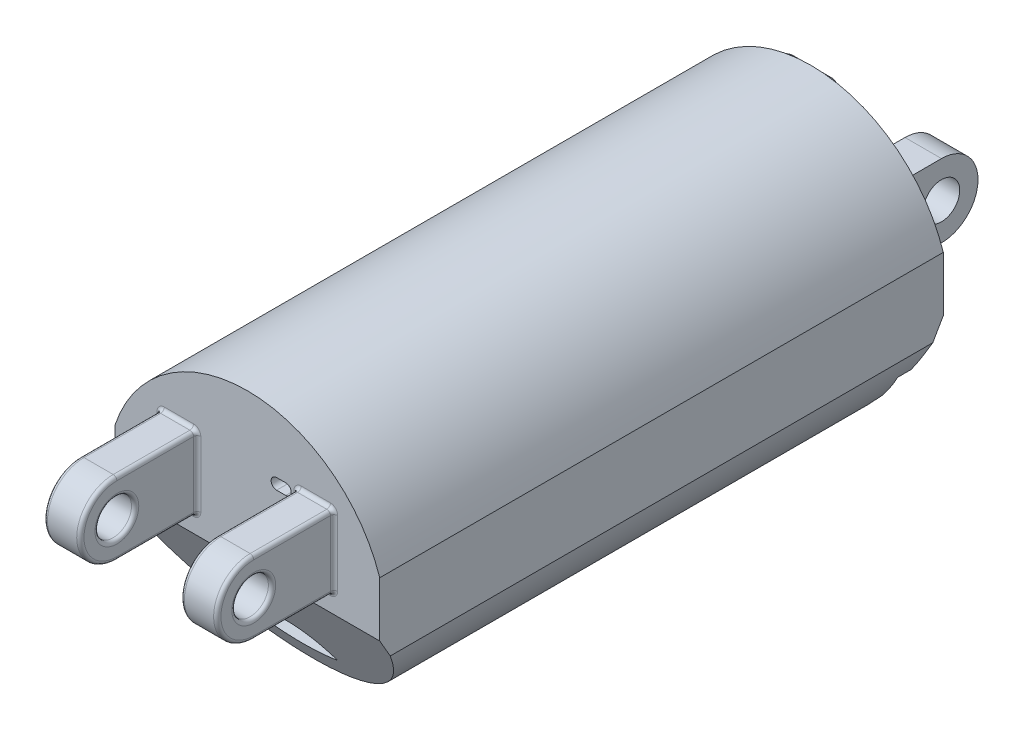
from build123d import *

# Parameters (mm, degrees)
BOSS_EXTRUDE1_DEPTH     = 19.605625
CUT_EXTRUDE1_DEPTH      = 30.35126084
CUT_EXTRUDE2_DEPTH      = 45.884720204
SKETCH4_R               = 1.27
BOSS_EXTRUDE2_DEPTH     = 0.635
SKETCH5_R               = 1.27
BOSS_EXTRUDE3_DEPTH     = 1.27
MIRROR2_COPY_1_SKETCH_R = 1.27
MIRROR2_COPY_1_DEPTH    = 0.635
MIRROR2_COPY_2_SKETCH_R = 1.27
MIRROR2_COPY_2_DEPTH    = 1.27
SKETCH10_R              = 1.27
BOSS_EXTRUDE6_DEPTH     = 2.54
BOSS_EXTRUDE7_START     = -2.54
BOSS_EXTRUDE7_DEPTH     = 2.54
CUT_EXTRUDE5_REACH      = 35.755
SKETCH11_R              = 1.27
CUT_EXTRUDE7_DEPTH      = 13.97
CUT_EXTRUDE8_DEPTH      = 16.51
FILLET1_R               = 0.254
SKETCH18_W              = 1.905
SKETCH18_H              = 11.7475
CUT_EXTRUDE9_DEPTH      = 2.54
SKETCH19_W              = 0.284935898
SKETCH19_H              = 2.320192308
CUT_EXTRUDE10_DEPTH     = 1


with BuildPart() as part:
    # Sketch1 → Boss-Extrude1 (new, symmetric)
    with BuildSketch(Plane.XY):
        with BuildLine():
            Line((0, 0), (0, 5.08))
            ThreePointArc((0, 5.08), (9.2075, 11.7475), (18.415, 5.08))
            Line((18.415, 5.08), (18.415, 0))
            ThreePointArc((18.415, 0), (9.2075, -6.6675), (0, 0))
        make_face()
    extrude(amount=BOSS_EXTRUDE1_DEPTH, both=True)

    # Sketch2 → Cut-Extrude1 (cut, through all)
    with BuildSketch(Plane(origin=(0, 0, 0), x_dir=(0, 0, -1), z_dir=(1, 0, 0))):
        Polygon((-19.605625, 1.27), (-19.605625, -6.6675), (-15.022907238, -6.6675), align=None)
        Polygon((19.605625, -6.6675), (15.022907238, -6.6675), (19.605625, 1.27), align=None)
    extrude(amount=CUT_EXTRUDE1_DEPTH, mode=Mode.SUBTRACT)

    # Sketch3 → Cut-Extrude2 (cut, through all)
    with BuildSketch(Plane.XY.offset(19.605625)):
        with BuildLine():
            ThreePointArc((6.530334947, -4.960627925), (9.2075, -3.4925), (11.884665053, -4.960627925))
            ThreePointArc((11.884665053, -4.960627925), (9.2075, -5.3975), (6.530334947, -4.960627925))
        make_face()
    extrude(amount=-CUT_EXTRUDE2_DEPTH, mode=Mode.SUBTRACT)

    # Sketch4 → Boss-Extrude2 (add, symmetric)
    with BuildSketch(Plane(origin=(14.605, 0, 0), x_dir=(0, 0, -1), z_dir=(1, 0, 0))):
        with BuildLine():
            Line((-19.605625, 7.62), (-22.653625, 7.62))
            ThreePointArc((-22.653625, 7.62), (-25.193625, 5.08), (-22.653625, 2.54))
            Line((-22.653625, 2.54), (-19.605625, 2.54))
            Line((-19.605625, 2.54), (-19.605625, 7.62))
        make_face()
        with Locations((-22.653625, 5.08)):
            Circle(SKETCH4_R, mode=Mode.SUBTRACT)
    boss_extrude2 = extrude(amount=BOSS_EXTRUDE2_DEPTH, both=True)

    # Sketch5 → Boss-Extrude3 (add)
    with BuildSketch(Plane.ZY.offset(-13.97)):
        with BuildLine():
            Line((19.605625, 7.62), (19.605625, 2.54))
            Line((19.605625, 2.54), (22.653625, 2.54))
            ThreePointArc((22.653625, 2.54), (25.193625, 5.08), (22.653625, 7.62))
            Line((22.653625, 7.62), (19.605625, 7.62))
        make_face()
        with Locations((22.653625, 5.08)):
            Circle(SKETCH5_R, mode=Mode.SUBTRACT)
    boss_extrude3 = extrude(amount=BOSS_EXTRUDE3_DEPTH)

    # Mirror1: Boss-Extrude2, Boss-Extrude3 across plane
    add(boss_extrude2.mirror(Plane(origin=(9.2075, 0, 0), x_dir=(0, 0, 1), z_dir=(1, 0, 0))))
    add(boss_extrude3.mirror(Plane(origin=(9.2075, 0, 0), x_dir=(0, 0, 1), z_dir=(1, 0, 0))))

    # Mirror2: Boss-Extrude2, Boss-Extrude3 across plane
    add(boss_extrude2.mirror(Plane.XY))
    add(boss_extrude3.mirror(Plane.XY))

    # Mirror2 copy 1 sketch → Mirror2 copy 1 (add, symmetric)
    with BuildSketch(Plane.ZY.offset(-3.81)):
        with BuildLine():
            Line((-19.605625, 7.62), (-22.653625, 7.62))
            ThreePointArc((-22.653625, 7.62), (-25.193625, 5.08), (-22.653625, 2.54))
            Line((-22.653625, 2.54), (-19.605625, 2.54))
            Line((-19.605625, 2.54), (-19.605625, 7.62))
        make_face()
        with Locations((-22.653625, 5.08)):
            Circle(MIRROR2_COPY_1_SKETCH_R, mode=Mode.SUBTRACT)
    extrude(amount=MIRROR2_COPY_1_DEPTH, both=True)

    # Mirror2 copy 2 sketch → Mirror2 copy 2 (add)
    with BuildSketch(Plane(origin=(4.445, 0, 0), x_dir=(0, 0, -1), z_dir=(1, 0, 0))):
        with BuildLine():
            Line((19.605625, 7.62), (19.605625, 2.54))
            Line((19.605625, 2.54), (22.653625, 2.54))
            ThreePointArc((22.653625, 2.54), (25.193625, 5.08), (22.653625, 7.62))
            Line((22.653625, 7.62), (19.605625, 7.62))
        make_face()
        with Locations((22.653625, 5.08)):
            Circle(MIRROR2_COPY_2_SKETCH_R, mode=Mode.SUBTRACT)
    extrude(amount=MIRROR2_COPY_2_DEPTH)

    # Sketch10 → Boss-Extrude6 (add)
    with BuildSketch(Plane(origin=(15.24, 0, 0), x_dir=(0, 0, -1), z_dir=(1, 0, 0))):
        with BuildLine():
            Line((-19.605625, 7.62), (-25.193625, 7.62))
            ThreePointArc((-25.193625, 7.62), (-27.733625, 5.08), (-25.193625, 2.54))
            Line((-25.193625, 2.54), (-19.605625, 2.54))
            Line((-19.605625, 2.54), (-19.605625, 7.62))
        make_face()
        with Locations((-25.193625, 5.08)):
            Circle(SKETCH10_R, mode=Mode.SUBTRACT)
    extrude(amount=-BOSS_EXTRUDE6_DEPTH)

    # Sketch12 → Boss-Extrude7 (add)
    with BuildSketch(Plane.ZY.offset(-3.175).offset(BOSS_EXTRUDE7_START)):
        with BuildLine():
            Line((19.605625, 7.62), (25.193625, 7.62))
            ThreePointArc((25.193625, 7.62), (27.733625, 5.08), (25.193625, 2.54))
            Line((25.193625, 2.54), (19.605625, 2.54))
            Line((19.605625, 2.54), (19.605625, 7.62))
        make_face()
    extrude(amount=BOSS_EXTRUDE7_DEPTH)

    # Sketch11 → Cut-Extrude5 (cut, up to next)
    with BuildSketch(Plane(origin=(15.24, 0, 0), x_dir=(0, 0, -1), z_dir=(1, 0, 0)), mode=Mode.PRIVATE) as cut_extrude5_sk1:
        with Locations((-25.193625, 5.08)):
            Circle(SKETCH11_R)
    cut_extrude5_tool1 = extrude(cut_extrude5_sk1.sketch, amount=-CUT_EXTRUDE5_REACH, mode=Mode.PRIVATE) & part.part
    add(cut_extrude5_tool1.solids().sort_by_distance((15.24, 5.08, 25.193625))[0], mode=Mode.SUBTRACT)
    add(cut_extrude5_tool1.solids().sort_by_distance((15.24, 5.08, 25.193625))[1], mode=Mode.SUBTRACT)

    # Sketch16 → Cut-Extrude7 (cut)
    with BuildSketch(Plane.XY.offset(19.605625)):
        with BuildLine():
            Line((11.2395, 7.5311), (11.8745, 7.5311))
            ThreePointArc((11.8745, 7.5311), (12.2555, 7.1501), (11.8745, 6.7691))
            Line((11.8745, 6.7691), (11.2395, 6.7691))
            ThreePointArc((11.2395, 6.7691), (10.8585, 7.1501), (11.2395, 7.5311))
        make_face()
    extrude(amount=-CUT_EXTRUDE7_DEPTH, mode=Mode.SUBTRACT)

    # Sketch17 → Cut-Extrude8 (cut)
    with BuildSketch(Plane(origin=(0, 0, -19.605625), x_dir=(-1, 0, 0), z_dir=(0, 0, -1))):
        with BuildLine():
            Line((-7.5565, 7.5311), (-6.9215, 7.5311))
            ThreePointArc((-6.9215, 7.5311), (-6.5405, 7.1501), (-6.9215, 6.7691))
            Line((-6.9215, 6.7691), (-7.5565, 6.7691))
            ThreePointArc((-7.5565, 6.7691), (-7.9375, 7.1501), (-7.5565, 7.5311))
        make_face()
    extrude(amount=-CUT_EXTRUDE8_DEPTH, mode=Mode.SUBTRACT)

    # Fillet1
    fillet1_edges = [part.edges().sort_by_distance(p)[0] for p in [
        (3.175, 5.08, 19.605625),
        (4.445, 7.62, 19.605625),
        (3.175, 2.54, 22.399625),
        (4.445, 2.54, 19.605625),
        (3.175, 7.62, 22.399625),
        (5.715, 7.62, 22.399625),
        (5.715, 2.54, 22.399625),
        (5.715, 5.08, 19.605625),
        (15.24, 3.850327788, 25.511125),
        (12.7, 5.08, 27.733625),
        (15.24, 5.08, 27.733625),
        (12.7, 3.850327788, 25.511125),
        (3.175, 5.08, 27.733625),
        (5.715, 5.08, 27.733625),
        (5.715, 5.08, 26.463625),
        (3.175, 5.08, 26.463625),
        (15.24, 5.08, 19.605625),
        (15.24, 7.62, 22.399625),
        (15.24, 2.54, 22.399625),
        (13.97, 2.54, 19.605625),
        (13.97, 7.62, 19.605625),
        (12.7, 7.62, 22.399625),
        (12.7, 5.08, 19.605625),
        (12.7, 2.54, 22.399625),
    ]]
    fillet(fillet1_edges, radius=FILLET1_R)

    # Sketch18 → Cut-Extrude9 (cut)
    with BuildSketch(Plane(origin=(0, 0, -19.605625), x_dir=(-1, 0, 0), z_dir=(0, 0, -1))):
        with Locations((-16.8275, -0.79375)):
            Rectangle(SKETCH18_W, SKETCH18_H)
        with Locations((-1.5875, -0.79375)):
            Rectangle(SKETCH18_W, SKETCH18_H)
    extrude(amount=-CUT_EXTRUDE9_DEPTH, mode=Mode.SUBTRACT)

    # Sketch19 → Cut-Extrude10 (cut)
    # profile 1 of 5: a face of its own
    with BuildSketch(Plane.ZY):
        Polygon((-8.545405736, 1.375249249), (-8.126270119, 4.550249249), (-8.085564991, 4.550249249), (-6.774732659, 1.945121044), (-5.467080416, 4.550249249), (-5.42573927, 4.550249249), (-5.004059583, 1.375249249), (-5.290267515, 1.375249249), (-5.594283942, 3.65982457), (-6.740387708, 1.375249249), (-6.804625488, 1.375249249), (-7.955181377, 3.664912711), (-8.258561786, 1.375249249), align=None)
    # profile 2 of 5: a face of its own
    with BuildSketch(Plane.ZY):
        with BuildLine():
            add(Edge.make_bspline(
                [(-4.333697002, 4.672364634), (-4.316015595, 4.671544438), (-4.281392002, 4.669938338), (-4.231323823, 4.656184713), (-4.185733534, 4.632871427), (-4.145295162, 4.60159343), (-4.110595236, 4.564809292), (-4.086301306, 4.521936843), (-4.070687204, 4.475619363), (-4.068801657, 4.443311389), (-4.067841634, 4.426861829)],
                knots=[0, 0, 0, 0, 1.055194115, 2.066272739, 3.074728998, 4.095836921, 5.109056067, 6.073838105, 7.019297344, 8, 8, 8, 8], degree=3))
            add(Edge.make_bspline(
                [(-4.067841634, 4.426861829), (-4.068823307, 4.41083928), (-4.07076396, 4.379164595), (-4.086289246, 4.333650088), (-4.110802276, 4.291373346), (-4.145272911, 4.25466063), (-4.18573943, 4.223399925), (-4.231322257, 4.200082054), (-4.281392414, 4.186329644), (-4.316015734, 4.184723376), (-4.333697002, 4.183903095)],
                knots=[0, 0, 0, 0, 0.96129708, 1.900370562, 2.859976407, 3.87933698, 4.906634145, 5.921202961, 6.938410037, 8, 8, 8, 8], degree=3))
            add(Edge.make_bspline(
                [(-4.333697002, 4.183903095), (-4.351176081, 4.184692056), (-4.385196823, 4.186227664), (-4.434515315, 4.200351895), (-4.479716874, 4.223407904), (-4.520234112, 4.254455943), (-4.554007216, 4.291598814), (-4.578589268, 4.333624288), (-4.594078698, 4.379171164), (-4.596024183, 4.410841486), (-4.5970083, 4.426861829)],
                knots=[0, 0, 0, 0, 1.054934014, 2.053291228, 3.073705704, 4.106921865, 5.123545215, 6.088680038, 7.033164197, 8, 8, 8, 8], degree=3))
            add(Edge.make_bspline(
                [(-4.5970083, 4.426861829), (-4.596045743, 4.4433091), (-4.59415522, 4.475612577), (-4.578577658, 4.521963072), (-4.554211975, 4.564582005), (-4.52021175, 4.601797994), (-4.479722825, 4.632863496), (-4.434513778, 4.655914886), (-4.385197229, 4.670040315), (-4.351176218, 4.671575758), (-4.333697002, 4.672364634)],
                knots=[0, 0, 0, 0, 0.98631895, 1.937192651, 2.907499808, 3.917963147, 4.944918757, 5.95915025, 6.951458133, 8, 8, 8, 8], degree=3))
        make_face()
    # profile 3 of 5: a face of its own
    with BuildSketch(Plane.ZY):
        with Locations((-4.332424967, 2.535345403)):
            Rectangle(SKETCH19_W, SKETCH19_H)
    # profile 4 of 5: a face of its own
    with BuildSketch(Plane.ZY):
        with BuildLine():
            Line((-1.137072403, 4.631659506), (-1.137072403, 1.375249249))
            Line((-1.137072403, 1.375249249), (-1.4220083, 1.375249249))
            Line((-1.4220083, 1.375249249), (-1.4220083, 1.776576373))
            add(Edge.make_bspline(
                [(-1.4220083, 1.776576373), (-1.454138203, 1.740254741), (-1.516840113, 1.66937262), (-1.621561699, 1.576769506), (-1.732567117, 1.500226315), (-1.849317601, 1.438404605), (-1.971707722, 1.391966097), (-2.099466173, 1.358958653), (-2.232645068, 1.337737102), (-2.323588276, 1.335617997), (-2.369674567, 1.334544121)],
                knots=[0, 0, 0, 0, 1.074387032, 2.096679803, 3.090159297, 4.057316773, 5.018401886, 5.985159533, 6.978961417, 8, 8, 8, 8], degree=3))
            add(Edge.make_bspline(
                [(-2.369674567, 1.334544121), (-2.410648353, 1.335656616), (-2.491450475, 1.337850505), (-2.610312566, 1.354870595), (-2.72469625, 1.382203373), (-2.834709612, 1.420213465), (-2.939640772, 1.470633211), (-3.040388146, 1.530995629), (-3.136429802, 1.602878382), (-3.226301841, 1.685054665), (-3.309062299, 1.774312974), (-3.38168931, 1.869513578), (-3.44224389, 1.97024481), (-3.492880677, 2.075231314), (-3.531884504, 2.185281277), (-3.559074872, 2.300014136), (-3.576075135, 2.419294236), (-3.578268117, 2.500519375), (-3.579380095, 2.541705579)],
                knots=[0, 0, 0, 0, 1.033919861, 2.038935746, 3.024066025, 3.998881131, 4.97069526, 5.957263378, 6.95902576, 7.993208707, 9.027059324, 10.027763471, 11.009749337, 11.988697705, 12.965288445, 13.950418724, 14.960734635, 16, 16, 16, 16], degree=3))
            add(Edge.make_bspline(
                [(-3.579380095, 2.541705579), (-3.578243471, 2.58204051), (-3.575996427, 2.661780493), (-3.55925672, 2.779054741), (-3.531107162, 2.892010592), (-3.491603044, 3.00028439), (-3.440946413, 3.10400715), (-3.379325934, 3.20325223), (-3.306737157, 3.29829304), (-3.223051045, 3.386894796), (-3.132395932, 3.468737782), (-3.03541444, 3.539865987), (-2.934519035, 3.601294843), (-2.828144732, 3.649966211), (-2.717866002, 3.68934447), (-2.60270109, 3.716588662), (-2.483129158, 3.732642661), (-2.401948497, 3.734967454), (-2.36077032, 3.736146685)],
                knots=[0, 0, 0, 0, 1.020392517, 2.01726096, 2.990465484, 3.961182959, 4.928053699, 5.906110375, 6.912531644, 7.948652711, 8.985773172, 9.998621852, 10.987621588, 11.969261332, 12.953316658, 13.946091881, 14.958173133, 16, 16, 16, 16], degree=3))
            add(Edge.make_bspline(
                [(-2.36077032, 3.736146685), (-2.313402216, 3.734725105), (-2.220423891, 3.731934702), (-2.084444518, 3.708615354), (-1.9558229, 3.669460458), (-1.833818547, 3.615856224), (-1.71915881, 3.546186971), (-1.611003215, 3.462048158), (-1.511232629, 3.361058533), (-1.45220319, 3.285210891), (-1.4220083, 3.246413111)],
                knots=[0, 0, 0, 0, 1.031072012, 2.023879775, 2.993683497, 3.952812103, 4.918022106, 5.908088563, 6.929940113, 8, 8, 8, 8], degree=3))
            Line((-1.4220083, 3.246413111), (-1.4220083, 4.631659506))
            Line((-1.4220083, 4.631659506), (-1.137072403, 4.631659506))
        make_face()
        with BuildLine():
            add(Edge.make_bspline(
                [(-2.356954214, 3.451210788), (-2.398605078, 3.449728845), (-2.480817258, 3.446803725), (-2.601507174, 3.423967769), (-2.716998628, 3.385972459), (-2.826713995, 3.334009591), (-2.928920163, 3.268669237), (-3.020263707, 3.189637697), (-3.101491729, 3.099071262), (-3.169807083, 2.997378634), (-3.225497034, 2.888359937), (-3.264655699, 2.774400625), (-3.290481373, 2.65755611), (-3.293119817, 2.578305673), (-3.294444198, 2.538525491)],
                knots=[0, 0, 0, 0, 1.031046209, 2.035121221, 3.029706178, 4.034933723, 5.034054252, 6.02443088, 7.017295772, 8.038157696, 9.050218397, 10.03989886, 11.016116709, 12, 12, 12, 12], degree=3))
            add(Edge.make_bspline(
                [(-3.294444198, 2.538525491), (-3.292752473, 2.498983037), (-3.289375655, 2.420053121), (-3.265108954, 2.303049312), (-3.224396497, 2.189063145), (-3.168841197, 2.079062101), (-3.099275473, 1.976932239), (-3.018640767, 1.884639413), (-2.926157298, 1.805273858), (-2.823715916, 1.738836917), (-2.714307257, 1.685168058), (-2.599250762, 1.647824942), (-2.480709291, 1.623715099), (-2.400107531, 1.620898895), (-2.359498284, 1.619480018)],
                knots=[0, 0, 0, 0, 0.979072187, 1.954306742, 2.945804271, 3.96968567, 4.997920485, 5.998718438, 6.996577872, 8.005894225, 9.015743152, 10.005417472, 10.995077863, 12, 12, 12, 12], degree=3))
            add(Edge.make_bspline(
                [(-2.359498284, 1.619480018), (-2.318271814, 1.620985843), (-2.236276453, 1.623980778), (-2.115228483, 1.646914497), (-1.997758052, 1.684804765), (-1.885465352, 1.737327544), (-1.780857147, 1.802421717), (-1.686969787, 1.878628149), (-1.607580301, 1.967258895), (-1.540277006, 2.064664677), (-1.487503592, 2.171446274), (-1.449062453, 2.28514229), (-1.426334981, 2.405756683), (-1.423470469, 2.488183245), (-1.4220083, 2.530257262)],
                knots=[0, 0, 0, 0, 1.01762866, 2.023962475, 3.030623092, 4.058876274, 5.077231937, 6.066672613, 7.034107872, 8.005628644, 8.981990164, 9.965428785, 10.961468474, 12, 12, 12, 12], degree=3))
            add(Edge.make_bspline(
                [(-1.4220083, 2.530257262), (-1.422878846, 2.562313723), (-1.424592355, 2.625410981), (-1.437682943, 2.718055229), (-1.45850634, 2.806713681), (-1.487848937, 2.891479549), (-1.526394603, 2.97188417), (-1.572883647, 3.048504867), (-1.628133591, 3.120943137), (-1.691255037, 3.188201494), (-1.760347756, 3.249548356), (-1.833458518, 3.304307346), (-1.911453524, 3.349291447), (-1.993021122, 3.386521744), (-2.078302833, 3.416148258), (-2.167992609, 3.435912809), (-2.261137119, 3.449483957), (-2.324678898, 3.450629117), (-2.356954214, 3.451210788)],
                knots=[0, 0, 0, 0, 1.050140795, 2.067009409, 3.05949893, 4.030605086, 5.00011959, 5.97591094, 6.962425594, 7.979863591, 8.993523472, 9.986985069, 10.967611495, 11.937549037, 12.921786183, 13.919465291, 14.943216303, 16, 16, 16, 16], degree=3))
        make_face(mode=Mode.SUBTRACT)
    # profile 5 of 5: a face of its own
    with BuildSketch(Plane.ZY):
        with BuildLine():
            Line((0.938889135, 3.817556941), (0.653953238, 3.817556941))
            add(Edge.make_bspline(
                [(0.653953238, 3.817556941), (0.661672616, 3.849517838), (0.676763369, 3.911998776), (0.708239025, 4.001268219), (0.742528349, 4.085744557), (0.783702751, 4.163845995), (0.828614264, 4.237142142), (0.880069876, 4.303970562), (0.935695624, 4.366030895), (0.997222542, 4.421106475), (1.0617464, 4.470979129), (1.130176376, 4.513501503), (1.201135715, 4.55008127), (1.275116057, 4.580216766), (1.352337656, 4.602918491), (1.432102386, 4.619389308), (1.514619275, 4.630085533), (1.570633161, 4.631129439), (1.599075433, 4.631659506)],
                knots=[0, 0, 0, 0, 1.162005537, 2.271625781, 3.343758855, 4.383309926, 5.390229558, 6.379919256, 7.361854164, 8.333198761, 9.295911338, 10.242430842, 11.177959212, 12.116337295, 13.062827104, 14.020064771, 14.994644689, 16, 16, 16, 16], degree=3))
            add(Edge.make_bspline(
                [(1.599075433, 4.631659506), (1.640516207, 4.630408347), (1.722493809, 4.62793332), (1.842928859, 4.605332367), (1.959067474, 4.56956814), (2.069638434, 4.520152688), (2.172343727, 4.459204196), (2.263725839, 4.386664757), (2.342546131, 4.303933962), (2.408671745, 4.212555135), (2.460446923, 4.114896209), (2.498625276, 4.014384638), (2.521867801, 3.91125885), (2.52488002, 3.841629032), (2.526389135, 3.806744642)],
                knots=[0, 0, 0, 0, 1.083050992, 2.142477498, 3.193116406, 4.255571735, 5.30263384, 6.308962982, 7.297363603, 8.282367274, 9.249857812, 10.179914175, 11.08814088, 12, 12, 12, 12], degree=3))
            add(Edge.make_bspline(
                [(2.526389135, 3.806744642), (2.525333592, 3.773174192), (2.523268058, 3.707482032), (2.505729625, 3.611577531), (2.476214586, 3.521188365), (2.435329873, 3.435934025), (2.382405753, 3.356355063), (2.31829552, 3.282272434), (2.242546677, 3.213357555), (2.185143641, 3.173879176), (2.155590858, 3.153554538)],
                knots=[0, 0, 0, 0, 1.024540389, 2.004866551, 2.965041327, 3.920577974, 4.882998113, 5.874504559, 6.905732034, 8, 8, 8, 8], degree=3))
            add(Edge.make_bspline(
                [(2.155590858, 3.153554538), (2.189365378, 3.137245768), (2.256282471, 3.104933378), (2.347496166, 3.041564226), (2.430298239, 2.968397397), (2.476475184, 2.911299419), (2.499676395, 2.882611028)],
                knots=[0, 0, 0, 0, 1.015518401, 2.012035669, 3.001164323, 4, 4, 4, 4], degree=3))
            add(Edge.make_bspline(
                [(2.499676395, 2.882611028), (2.514953898, 2.861694353), (2.545258726, 2.820203529), (2.582665245, 2.753495486), (2.616600656, 2.686048063), (2.64304407, 2.616053459), (2.663521792, 2.54432294), (2.678159478, 2.470733337), (2.687252806, 2.39522456), (2.688555057, 2.344141096), (2.689209648, 2.318463392)],
                knots=[0, 0, 0, 0, 1.025084078, 2.033381695, 3.024893161, 4.013698104, 4.991890475, 5.976764909, 6.982997093, 8, 8, 8, 8], degree=3))
            add(Edge.make_bspline(
                [(2.689209648, 2.318463392), (2.687581768, 2.274004573), (2.684333669, 2.18529616), (2.655301401, 2.054236948), (2.610295104, 1.926125243), (2.546380598, 1.803593067), (2.468486501, 1.688948007), (2.375815214, 1.586371641), (2.269419686, 1.498198622), (2.150760276, 1.424529343), (2.022202595, 1.365639514), (1.88470188, 1.324765976), (1.740239331, 1.298144962), (1.641172711, 1.295290303), (1.590807204, 1.293838993)],
                knots=[0, 0, 0, 0, 0.955779014, 1.907060117, 2.875433937, 3.871313158, 4.872415639, 5.851225146, 6.836215519, 7.83643374, 8.849228613, 9.86973379, 10.916971861, 12, 12, 12, 12], degree=3))
            add(Edge.make_bspline(
                [(1.590807204, 1.293838993), (1.556862553, 1.294626586), (1.490070799, 1.296176308), (1.391878483, 1.306770467), (1.298150942, 1.326119829), (1.208761449, 1.352157828), (1.123630595, 1.385170336), (1.043018156, 1.42628087), (0.966428182, 1.474642018), (0.894583419, 1.53082463), (0.827492432, 1.593672702), (0.766938175, 1.664301947), (0.711911078, 1.741406735), (0.663884541, 1.82588265), (0.62067102, 1.916637991), (0.585128295, 2.014834843), (0.553844957, 2.119595348), (0.539300315, 2.192600155), (0.531837853, 2.230056941)],
                knots=[0, 0, 0, 0, 1.048658725, 2.063410685, 3.046034179, 4.001477787, 4.936774919, 5.862367409, 6.792675028, 7.730719943, 8.675894397, 9.627829632, 10.600096036, 11.597688215, 12.626045268, 13.701542398, 14.82072376, 16, 16, 16, 16], degree=3))
            Line((0.531837853, 2.230056941), (0.816773751, 2.230056941))
            add(Edge.make_bspline(
                [(0.816773751, 2.230056941), (0.824197165, 2.205610337), (0.838636351, 2.158059567), (0.86321475, 2.089624432), (0.891216682, 2.026888198), (0.921256318, 1.969390652), (0.952805337, 1.916565544), (0.988106733, 1.869809706), (1.024545886, 1.827069486), (1.052013585, 1.802989731), (1.065456643, 1.791204778)],
                knots=[0, 0, 0, 0, 1.198163088, 2.33053128, 3.407730985, 4.417276592, 5.372219308, 6.28897303, 7.162600585, 8, 8, 8, 8], degree=3))
            add(Edge.make_bspline(
                [(1.065456643, 1.791204778), (1.083233538, 1.777499361), (1.118732453, 1.750130832), (1.176579349, 1.715204355), (1.237416781, 1.684941139), (1.30256295, 1.661823786), (1.370612063, 1.642249765), (1.44266403, 1.629440437), (1.518083177, 1.620651882), (1.569579648, 1.619876337), (1.595895345, 1.619480018)],
                knots=[0, 0, 0, 0, 0.946170439, 1.889420265, 2.845303464, 3.807233317, 4.801018734, 5.828864929, 6.890507805, 8, 8, 8, 8], degree=3))
            add(Edge.make_bspline(
                [(1.595895345, 1.619480018), (1.625607451, 1.620038732), (1.68370691, 1.62113125), (1.768483818, 1.631178498), (1.849135574, 1.645811087), (1.924766728, 1.668410722), (1.996367974, 1.696333351), (2.062935613, 1.731392976), (2.125343509, 1.772527116), (2.182792327, 1.819280496), (2.234450038, 1.870462852), (2.279933739, 1.923996138), (2.318600396, 1.979654641), (2.349791213, 2.037746365), (2.374420641, 2.098030751), (2.391187545, 2.160676975), (2.402845705, 2.225172352), (2.403795131, 2.269013631), (2.404273751, 2.291114634)],
                knots=[0, 0, 0, 0, 1.217147791, 2.380027433, 3.494444702, 4.572153297, 5.609568379, 6.639424714, 7.649109417, 8.668170816, 9.669597737, 10.625200337, 11.543417969, 12.441394052, 13.322311151, 14.205496177, 15.095365482, 16, 16, 16, 16], degree=3))
            add(Edge.make_bspline(
                [(2.404273751, 2.291114634), (2.402885549, 2.320697777), (2.400116052, 2.379716862), (2.378971841, 2.466546375), (2.344193014, 2.550206185), (2.295504379, 2.629268938), (2.236235539, 2.70254422), (2.166961659, 2.76792335), (2.087107481, 2.821871219), (2.013610885, 2.8591445), (1.948509636, 2.884578132), (1.892797109, 2.901518993), (1.830425047, 2.915864238), (1.762147716, 2.92921037), (1.687450656, 2.940569021), (1.606415187, 2.95004124), (1.519024889, 2.957620455), (1.458526474, 2.961005092), (1.427350674, 2.962749249)],
                knots=[0, 0, 0, 0, 1.07054697, 2.135767047, 3.216561865, 4.33974944, 5.486079747, 6.621378074, 7.775625952, 8.963672916, 9.598146892, 10.304877434, 11.070270905, 11.915000392, 12.823868403, 13.805723172, 14.86925407, 16, 16, 16, 16], degree=3))
            Line((1.427350674, 2.962749249), (1.427350674, 3.288390275))
            add(Edge.make_bspline(
                [(1.427350674, 3.288390275), (1.466631017, 3.289056847), (1.54357156, 3.290362497), (1.655961394, 3.30615405), (1.763433612, 3.327998619), (1.863606443, 3.361458758), (1.954909204, 3.400321027), (2.034120557, 3.445544103), (2.100130755, 3.495813197), (2.152619013, 3.551904207), (2.192106242, 3.612061429), (2.220977694, 3.674760111), (2.238032275, 3.740549795), (2.240308902, 3.785448529), (2.241453238, 3.808016677)],
                knots=[0, 0, 0, 0, 1.321986639, 2.589447074, 3.816329219, 5.01088745, 6.139805852, 7.153945165, 8.075214402, 8.924034688, 9.728124013, 10.488707548, 11.240355623, 12, 12, 12, 12], degree=3))
            add(Edge.make_bspline(
                [(2.241453238, 3.808016677), (2.241077308, 3.824597203), (2.240329413, 3.857583373), (2.230897597, 3.9057754), (2.21672436, 3.952494115), (2.197239177, 3.997540843), (2.171158639, 4.040603163), (2.139947494, 4.082048206), (2.102783575, 4.121639348), (2.060197348, 4.158542209), (2.014466639, 4.193711446), (1.9643472, 4.223568817), (1.911350214, 4.249100409), (1.855417006, 4.270154743), (1.79636606, 4.285992811), (1.734474826, 4.29736461), (1.669625284, 4.304474483), (1.625382356, 4.305498117), (1.602891539, 4.30601848)],
                knots=[0, 0, 0, 0, 0.884392785, 1.759457502, 2.611959086, 3.489218968, 4.37281399, 5.2945488, 6.255912374, 7.266815255, 8.301784654, 9.332968512, 10.37626691, 11.440494194, 12.520033166, 13.637162961, 14.798855837, 16, 16, 16, 16], degree=3))
            add(Edge.make_bspline(
                [(1.602891539, 4.30601848), (1.566740383, 4.304756316), (1.496128768, 4.302291016), (1.394333807, 4.280698282), (1.299701269, 4.246246735), (1.227366907, 4.20512321), (1.173952, 4.164528174), (1.135782206, 4.129074866), (1.0982986, 4.08967509), (1.063967165, 4.043902136), (1.0292472, 3.994855833), (0.997638205, 3.940042922), (0.966922627, 3.880893222), (0.9484146, 3.839077896), (0.938889135, 3.817556941)],
                knots=[0, 0, 0, 0, 1.472543308, 2.876219568, 4.221790263, 5.565193594, 6.249813518, 6.953379497, 7.687249741, 8.463570142, 9.283606569, 10.136032583, 11.040678096, 12, 12, 12, 12], degree=3))
        make_face()
    extrude(amount=-CUT_EXTRUDE10_DEPTH, mode=Mode.SUBTRACT)


solid = part.part
